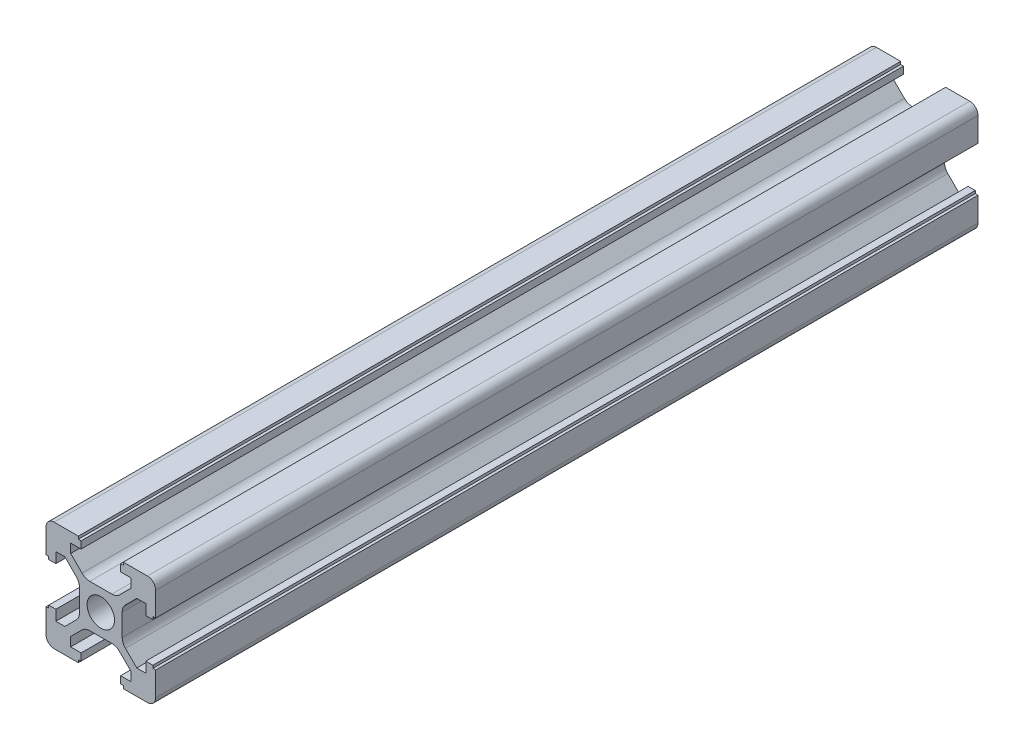
from build123d import *

# Parameters (mm, degrees)
SKETCH1_R           = 2.5
BOSS_EXTRUDE2_DEPTH = 150


with BuildPart() as part:
    # Sketch1 → Boss-Extrude2 (new body)
    with BuildSketch(Plane.XY):
        with BuildLine():
            Line((10, -4.1), (10, -8.5))
            ThreePointArc((10, -8.5), (9.560660172, -9.560660172), (8.5, -10))
            Line((8.5, -10), (4.1, -10))
            Line((4.1, -10), (4.1, -9.5))
            Line((4.1, -9.5), (3.6, -9.5))
            Line((3.6, -9.5), (3.6, -8.2))
            Line((3.6, -8.2), (5.5, -8.2))
            Line((5.5, -8.2), (5.5, -6.560660172))
            Line((5.5, -6.560660172), (3.425126266, -4.485786438))
            ThreePointArc((3.425126266, -4.485786438), (2.776279568, -4.052240935), (2.010912703, -3.9))
            Line((2.010912703, -3.9), (-2.010912703, -3.9))
            ThreePointArc((-2.010912703, -3.9), (-2.776279568, -4.052240935), (-3.425126266, -4.485786438))
            Line((-3.425126266, -4.485786438), (-5.5, -6.560660172))
            Line((-5.5, -6.560660172), (-5.5, -8.2))
            Line((-5.5, -8.2), (-3.6, -8.2))
            Line((-3.6, -8.2), (-3.6, -9.5))
            Line((-3.6, -9.5), (-4.1, -9.5))
            Line((-4.1, -9.5), (-4.1, -10))
            Line((-4.1, -10), (-8.5, -10))
            ThreePointArc((-8.5, -10), (-9.560660172, -9.560660172), (-10, -8.5))
            Line((-10, -8.5), (-10, -4.1))
            Line((-10, -4.1), (-9.5, -4.1))
            Line((-9.5, -4.1), (-9.5, -3.6))
            Line((-9.5, -3.6), (-8.2, -3.6))
            Line((-8.2, -3.6), (-8.2, -5.5))
            Line((-8.2, -5.5), (-6.560660172, -5.5))
            Line((-6.560660172, -5.5), (-4.485786438, -3.425126266))
            ThreePointArc((-4.485786438, -3.425126266), (-4.052240935, -2.776279568), (-3.9, -2.010912703))
            Line((-3.9, -2.010912703), (-3.9, 2.010912703))
            ThreePointArc((-3.9, 2.010912703), (-4.052240935, 2.776279568), (-4.485786438, 3.425126266))
            Line((-4.485786438, 3.425126266), (-6.560660172, 5.5))
            Line((-6.560660172, 5.5), (-8.2, 5.5))
            Line((-8.2, 5.5), (-8.2, 3.6))
            Line((-8.2, 3.6), (-9.5, 3.6))
            Line((-9.5, 3.6), (-9.5, 4.1))
            Line((-9.5, 4.1), (-10, 4.1))
            Line((-10, 4.1), (-10, 8.5))
            ThreePointArc((-10, 8.5), (-9.560660172, 9.560660172), (-8.5, 10))
            Line((-8.5, 10), (-4.1, 10))
            Line((-4.1, 10), (-4.1, 9.5))
            Line((-4.1, 9.5), (-3.6, 9.5))
            Line((-3.6, 9.5), (-3.6, 8.2))
            Line((-3.6, 8.2), (-5.5, 8.2))
            Line((-5.5, 8.2), (-5.5, 6.560660172))
            Line((-5.5, 6.560660172), (-3.425126266, 4.485786438))
            ThreePointArc((-3.425126266, 4.485786438), (-2.776279568, 4.052240935), (-2.010912703, 3.9))
            Line((-2.010912703, 3.9), (2.010912703, 3.9))
            ThreePointArc((2.010912703, 3.9), (2.776279568, 4.052240935), (3.425126266, 4.485786438))
            Line((3.425126266, 4.485786438), (5.5, 6.560660172))
            Line((5.5, 6.560660172), (5.5, 8.2))
            Line((5.5, 8.2), (3.6, 8.2))
            Line((3.6, 8.2), (3.6, 9.5))
            Line((3.6, 9.5), (4.1, 9.5))
            Line((4.1, 9.5), (4.1, 10))
            Line((4.1, 10), (8.5, 10))
            ThreePointArc((8.5, 10), (9.560660172, 9.560660172), (10, 8.5))
            Line((10, 8.5), (10, 4.1))
            Line((10, 4.1), (9.5, 4.1))
            Line((9.5, 4.1), (9.5, 3.6))
            Line((9.5, 3.6), (8.2, 3.6))
            Line((8.2, 3.6), (8.2, 5.5))
            Line((8.2, 5.5), (6.560660172, 5.5))
            Line((6.560660172, 5.5), (4.485786438, 3.425126266))
            ThreePointArc((4.485786438, 3.425126266), (4.052240935, 2.776279568), (3.9, 2.010912703))
            Line((3.9, 2.010912703), (3.9, -2.010912703))
            ThreePointArc((3.9, -2.010912703), (4.052240935, -2.776279568), (4.485786438, -3.425126266))
            Line((4.485786438, -3.425126266), (6.560660172, -5.5))
            Line((6.560660172, -5.5), (8.2, -5.5))
            Line((8.2, -5.5), (8.2, -3.6))
            Line((8.2, -3.6), (9.5, -3.6))
            Line((9.5, -3.6), (9.5, -4.1))
            Line((9.5, -4.1), (10, -4.1))
        make_face()
        Circle(SKETCH1_R, mode=Mode.SUBTRACT)
    extrude(amount=BOSS_EXTRUDE2_DEPTH)


solid = part.part
